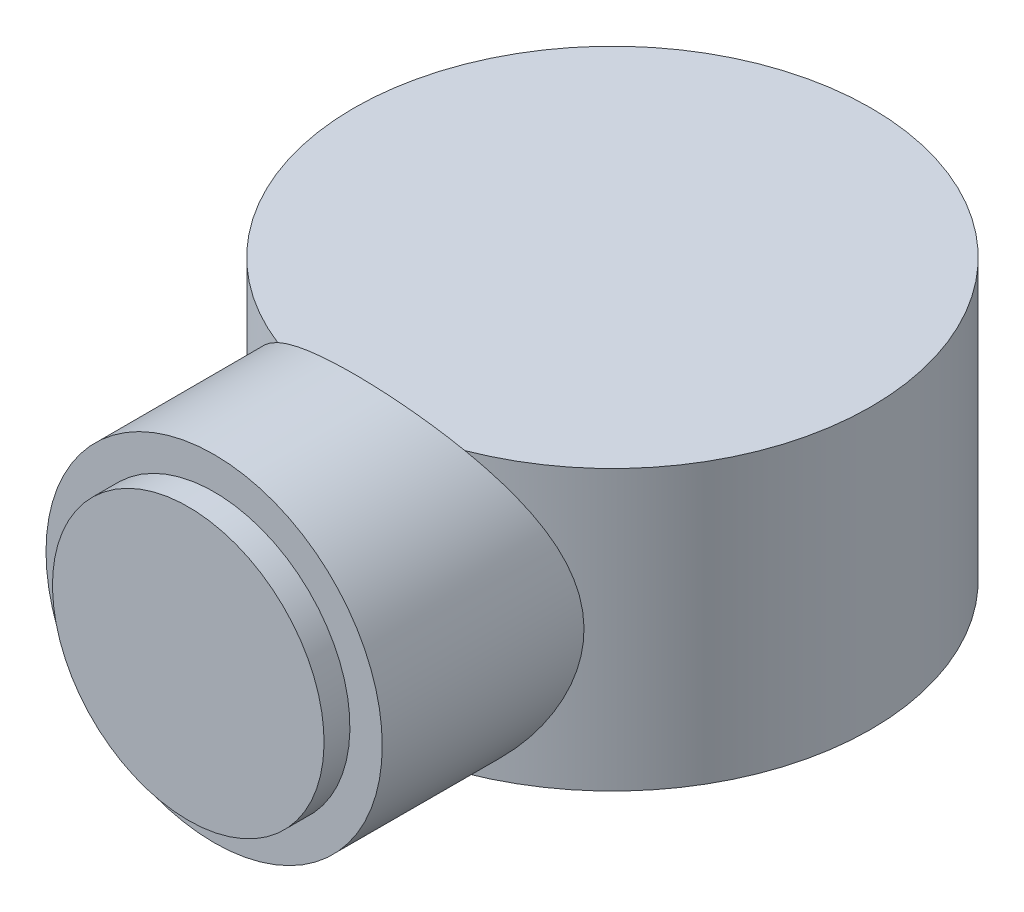
from build123d import *

# Parameters (mm, degrees)
SKETCH1_R                = 50
BOSS_EXTRUDE1_DEPTH      = 27
BOSS_EXTRUDE2_REACH      = 141.133
BOSS_EXTRUDE2_END_RADIUS = 50
SKETCH2_R                = 32.5
SKETCH3_R                = 26.25
BOSS_EXTRUDE3_DEPTH      = 5
BODY_MOVE_COPY2_ANGLE    = 120


with BuildPart() as part:
    # Sketch1 → Boss-Extrude1 (new, symmetric)
    with BuildSketch(Plane.XY):
        Circle(SKETCH1_R)
    extrude(amount=BOSS_EXTRUDE1_DEPTH, both=True)

    # Boss-Extrude2: up to this cylinder (the profile starts outside it)
    boss_extrude2_end = Plane(origin=(0, 0, 0), z_dir=(0, 0, -1)) * Cylinder(BOSS_EXTRUDE2_END_RADIUS, 383.266, mode=Mode.PRIVATE)
    # Sketch2 → Boss-Extrude2 (add, up to the surface)
    with BuildSketch(Plane(origin=(77, 0, 0), x_dir=(0, 0, -1), z_dir=(1, 0, 0)), mode=Mode.PRIVATE) as boss_extrude2_sk1:
        Circle(SKETCH2_R)
    boss_extrude2_tool1 = extrude(boss_extrude2_sk1.sketch, amount=-BOSS_EXTRUDE2_REACH, mode=Mode.PRIVATE) - boss_extrude2_end
    add(boss_extrude2_tool1.solids().sort_by_distance((77, 0, 0))[0])

    # Sketch3 → Boss-Extrude3 (add)
    with BuildSketch(Plane(origin=(77, 0, 0), x_dir=(0, 0, -1), z_dir=(1, 0, 0))):
        Circle(SKETCH3_R)
    extrude(amount=BOSS_EXTRUDE3_DEPTH)


with BuildPart() as part_1:
    # Body-Move/Copy1: moved
    add(part.part.moved(Location((-82, 0, 0))))


with BuildPart() as part_2:
    # Body-Move/Copy2: moved
    add(part_1.part.rotate(Axis((0, 0, 0), (-0.5773502691896272, -0.5773502691896252, -0.5773502691896252)), BODY_MOVE_COPY2_ANGLE))


solid = part_2.part
